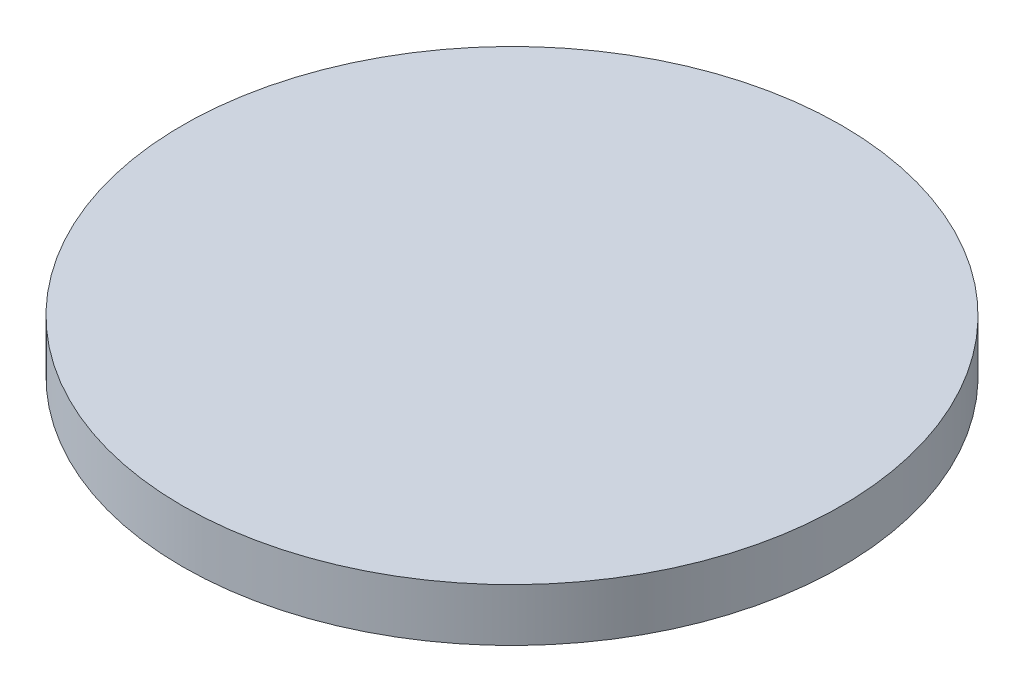
from build123d import *

# Parameters (mm, degrees)
SKETCH1_R           = 6.25
BOSS_EXTRUDE1_DEPTH = 1


with BuildPart() as part:
    # Sketch1 → Boss-Extrude1 (new body)
    with BuildSketch(Plane(origin=(0, 0, 0), x_dir=(1, 0, 0), z_dir=(0, 1, 0))):
        with Locations(Location((0, 0, 0), (0, 0, 270))):
            Circle(SKETCH1_R)
    extrude(amount=BOSS_EXTRUDE1_DEPTH)


solid = part.part
